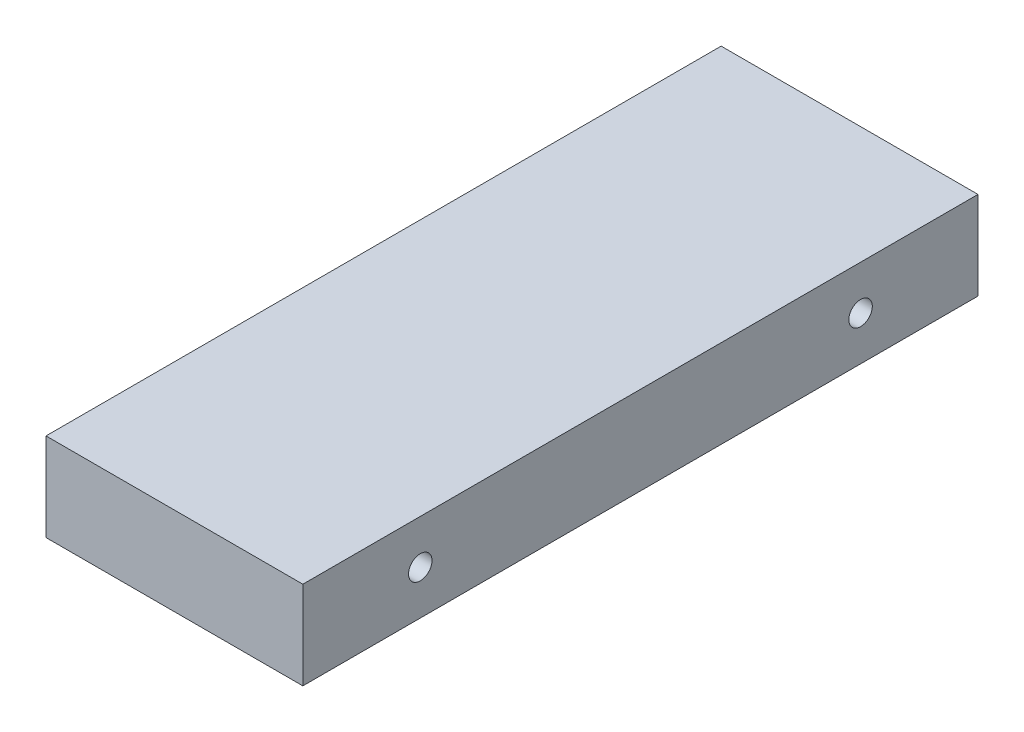
from build123d import *

# Parameters (mm, degrees)
SKETCH1_W           = 92
SKETCH1_H           = 12
BOSS_EXTRUDE1_DEPTH = 35
SKETCH1_4_R         = 4
CUT_EXTRUDE1_DEPTH  = 27
SKETCH1_5_R         = 1.6
CUT_EXTRUDE2_DEPTH  = 35
SKETCH1_6_R         = 1.621
CUT_EXTRUDE3_DEPTH  = 12


with BuildPart() as part:
    # Sketch1 → Boss-Extrude1 (new body)
    with BuildSketch(Plane(origin=(0, 0, 0), x_dir=(0, 0, -1), z_dir=(1, 0, 0))):
        Rectangle(SKETCH1_W, SKETCH1_H)
    extrude(amount=BOSS_EXTRUDE1_DEPTH)

    # Sketch1<4> → Cut-Extrude1 (cut)
    with BuildSketch(Plane(origin=(0, 0, 0), x_dir=(0, 0, -1), z_dir=(1, 0, 0))):
        with Locations((-30, 0)):
            Circle(SKETCH1_4_R)
        with Locations((30, 0)):
            Circle(SKETCH1_4_R)
    extrude(amount=CUT_EXTRUDE1_DEPTH, mode=Mode.SUBTRACT)

    # Sketch1<5> → Cut-Extrude2 (cut)
    with BuildSketch(Plane(origin=(0, 0, 0), x_dir=(0, 0, -1), z_dir=(1, 0, 0))):
        with Locations((-30, 0)):
            Circle(SKETCH1_5_R)
        with Locations((30, 0)):
            Circle(SKETCH1_5_R)
    extrude(amount=CUT_EXTRUDE2_DEPTH, mode=Mode.SUBTRACT)

    # Sketch1<6> → Cut-Extrude3 (cut)
    with BuildSketch(Plane(origin=(0, 0, 0), x_dir=(0, 0, -1), z_dir=(1, 0, 0))):
        with Locations((-42, 0)):
            Circle(SKETCH1_6_R)
        with Locations((42, 0)):
            Circle(SKETCH1_6_R)
    extrude(amount=CUT_EXTRUDE3_DEPTH, mode=Mode.SUBTRACT)


solid = part.part
